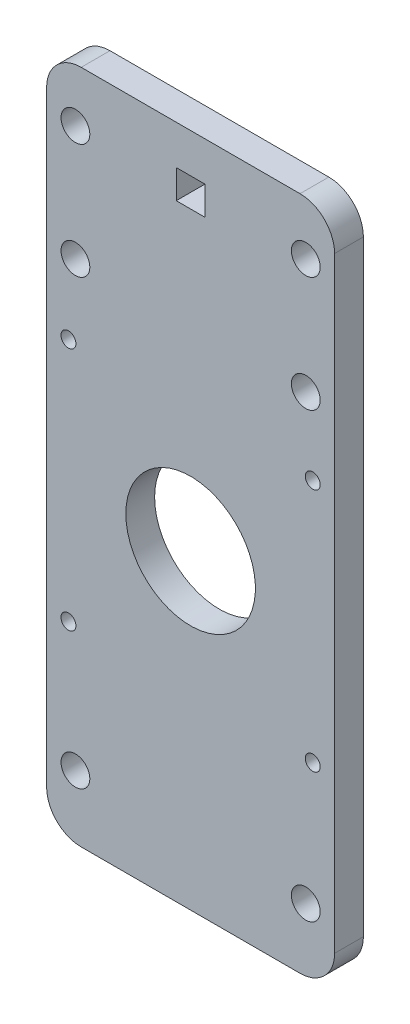
from build123d import *

# Parameters (mm, degrees)
BOSS_EXTRUDE1_DEPTH = 6.35
SKETCH2_R           = 1.35
SKETCH2_R_2         = 1.385
CUT_EXTRUDE1_DEPTH  = 38.116505762
SKETCH3_W           = 63.5
SKETCH3_H           = 88.9
SKETCH3_W_2         = 38.321076004
SKETCH3_H_2         = 47.237540142
BOSS_EXTRUDE2_DEPTH = 6.35
SKETCH5_W           = 27.94
SKETCH5_H           = 55.88
CUT_EXTRUDE3_DEPTH  = 61.153053743
SKETCH6_R           = 3.175
CUT_EXTRUDE4_DEPTH  = 61.153053743
SKETCH7_W           = 41.724968974
SKETCH7_H           = 57.858351452
BOSS_EXTRUDE3_DEPTH = 6.35
SKETCH8_R           = 14.2875
CUT_EXTRUDE5_DEPTH  = 6.35
SKETCH10_W          = 63.5
SKETCH10_H          = 60
SKETCH10_R          = 3.175
SKETCH10_W_2        = 6.33
SKETCH10_H_2        = 6.33
BOSS_EXTRUDE4_DEPTH = 6.35
FILLET1_R           = 7.62
SKETCH11_R          = 1.65
CUT_EXTRUDE6_DEPTH  = 104.404858197


with BuildPart() as part:
    # Sketch1 → Boss-Extrude1 (new body)
    with BuildSketch(Plane.XY):
        with BuildLine():
            Line((-19.69889026, 23.2987845), (-14.850045261, 29.75147823))
            ThreePointArc((-14.850045261, 29.75147823), (-14.144755454, 30.339267512), (-13.251155001, 30.55))
            Line((-13.251155001, 30.55), (13.251155001, 30.55))
            ThreePointArc((13.251155001, 30.55), (14.144755454, 30.339267512), (14.850045261, 29.75147823))
            Line((14.850045261, 29.75147823), (19.69889026, 23.2987845))
            ThreePointArc((19.69889026, 23.2987845), (19.997074131, 22.730638521), (20.1, 22.09730627))
            Line((20.1, 22.09730627), (20.1, -22.09730627))
            ThreePointArc((20.1, -22.09730627), (19.997074131, -22.730638521), (19.69889026, -23.2987845))
            Line((19.69889026, -23.2987845), (14.850045261, -29.75147823))
            ThreePointArc((14.850045261, -29.75147823), (14.144755454, -30.339267512), (13.251155001, -30.55))
            Line((13.251155001, -30.55), (-13.251155001, -30.55))
            ThreePointArc((-13.251155001, -30.55), (-14.144755454, -30.339267512), (-14.850045261, -29.75147823))
            Line((-14.850045261, -29.75147823), (-19.69889026, -23.2987845))
            ThreePointArc((-19.69889026, -23.2987845), (-19.997074131, -22.730638521), (-20.1, -22.09730627))
            Line((-20.1, -22.09730627), (-20.1, 22.09730627))
            ThreePointArc((-20.1, 22.09730627), (-19.997074131, 22.730638521), (-19.69889026, 23.2987845))
        make_face()
    extrude(amount=-BOSS_EXTRUDE1_DEPTH)

    # Sketch2 → Cut-Extrude1 (cut, through all)
    with BuildSketch(Plane(origin=(0, 0, -6.35), x_dir=(-1, 0, 0), z_dir=(0, 0, -1))):
        with Locations((17.3, 21.9487845)):
            Circle(SKETCH2_R)
        with Locations((17.3, -0.0512155)):
            Circle(SKETCH2_R)
        with Locations((17.3, -22.0512155)):
            Circle(SKETCH2_R)
        with Locations((11, -27.75)):
            Circle(SKETCH2_R_2)
        with Locations(Location((-11, -27.75, 0), (0, 0, 180))):
            Circle(SKETCH2_R_2)
        with Locations(Location((-17.3, -22.0512155, 0), (0, 0, 180))):
            Circle(SKETCH2_R)
        with Locations(Location((-17.3, -0.0512155, 0), (0, 0, 180))):
            Circle(SKETCH2_R)
        with Locations(Location((-17.3, 21.9487845, 0), (0, 0, 180))):
            Circle(SKETCH2_R)
    extrude(amount=-CUT_EXTRUDE1_DEPTH, mode=Mode.SUBTRACT)

    # Sketch3 → Boss-Extrude2 (add)
    with BuildSketch(Plane(origin=(0, 0, -6.35), x_dir=(-1, 0, 0), z_dir=(0, 0, -1))):
        with Locations((0, -6.2452155)):
            Rectangle(SKETCH3_W, SKETCH3_H)
        Rectangle(SKETCH3_W_2, SKETCH3_H_2, mode=Mode.SUBTRACT)
    extrude(amount=-BOSS_EXTRUDE2_DEPTH)

    # Sketch5 → Cut-Extrude3 (cut, through all)
    with BuildSketch(Plane.XY):
        with Locations((0, 3.0087845)):
            Rectangle(SKETCH5_W, SKETCH5_H)
    extrude(amount=-CUT_EXTRUDE3_DEPTH, mode=Mode.SUBTRACT)

    # Sketch6 → Cut-Extrude4 (cut, through all)
    with BuildSketch(Plane(origin=(0, 0, -6.35), x_dir=(-1, 0, 0), z_dir=(0, 0, -1))):
        with Locations((-25.4, -36.7252155)):
            Circle(SKETCH6_R)
        with Locations((25.4, -36.7252155)):
            Circle(SKETCH6_R)
    extrude(amount=-CUT_EXTRUDE4_DEPTH, mode=Mode.SUBTRACT)

    # Sketch7 → Boss-Extrude3 (add)
    with BuildSketch(Plane(origin=(0, 0, -6.35), x_dir=(-1, 0, 0), z_dir=(0, 0, -1))):
        with Locations((0, 3.16744248)):
            Rectangle(SKETCH7_W, SKETCH7_H)
    extrude(amount=-BOSS_EXTRUDE3_DEPTH)

    # Sketch8 → Cut-Extrude5 (cut)
    with BuildSketch(Plane(origin=(0, 0, -6.35), x_dir=(-1, 0, 0), z_dir=(0, 0, -1))):
        with Locations((0, 17.8847845)):
            Circle(SKETCH8_R)
    extrude(amount=-CUT_EXTRUDE5_DEPTH, mode=Mode.SUBTRACT)

    # Sketch10 → Boss-Extrude4 (add)
    with BuildSketch(Plane(origin=(0, 0, -6.35), x_dir=(-1, 0, 0), z_dir=(0, 0, -1))):
        with Locations((0, 68.2047845)):
            Rectangle(SKETCH10_W, SKETCH10_H)
        with Locations((-25.4, 86.3797845)):
            Circle(SKETCH10_R, mode=Mode.SUBTRACT)
        with Locations((-25.4, 60.9797845)):
            Circle(SKETCH10_R, mode=Mode.SUBTRACT)
        with Locations(Location((25.4, 60.9797845, 0), (0, 0, 180))):
            Circle(SKETCH10_R, mode=Mode.SUBTRACT)
        with Locations(Location((25.4, 86.3797845, 0), (0, 0, 180))):
            Circle(SKETCH10_R, mode=Mode.SUBTRACT)
        with Locations((0, 86.3797845)):
            Rectangle(SKETCH10_W_2, SKETCH10_H_2, mode=Mode.SUBTRACT)
    extrude(amount=-BOSS_EXTRUDE4_DEPTH)

    # Fillet1
    fillet1_edges = [part.edges().sort_by_distance(p)[0] for p in [
        (31.75, 98.2047845, -3.175),
        (-31.75, 98.2047845, -3.175),
        (-31.75, -50.6952155, -3.175),
        (31.75, -50.6952155, -3.175),
    ]]
    fillet(fillet1_edges, radius=FILLET1_R)

    # Sketch11 → Cut-Extrude6 (cut, through all)
    with BuildSketch(Plane.XY):
        with Locations((-26.94, 44.8247845)):
            Circle(SKETCH11_R)
        with Locations((26.94, 44.8247845)):
            Circle(SKETCH11_R)
        with Locations((-26.94, -9.055983818)):
            Circle(SKETCH11_R)
        with Locations((26.94, -9.055983818)):
            Circle(SKETCH11_R)
    extrude(amount=-CUT_EXTRUDE6_DEPTH, mode=Mode.SUBTRACT)


solid = part.part
